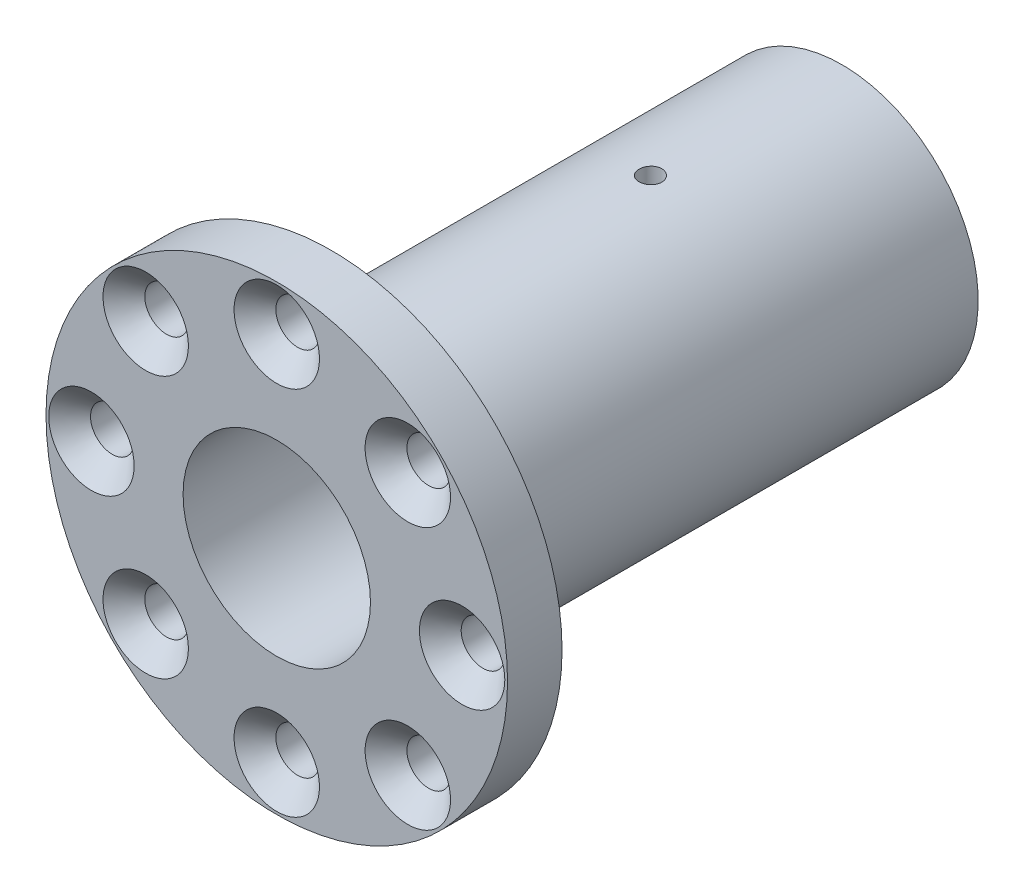
from build123d import *

# Parameters (mm, degrees)
SKETCH1_W                                       = 25.4
SKETCH1_H                                       = 6
SKETCH2_R                                       = 15
BOSS_EXTRUDE1_DEPTH                             = 56.2
CUT_EXTRUDE1_DEPTH                              = 24.1
SKETCH5_W                                       = 1.25
SKETCH5_H                                       = 16.341500105
M3X0_5_TAPPED_HOLE1_D                           = 2.5
M3X0_5_TAPPED_HOLE1_DEPTH                       = 12
M3X0_5_TAPPED_HOLE1_TIP                         = 0.751075774
CSK_FOR_M4_FLAT_HEAD_MACHINE_SCREW1_D           = 4.8
CSK_FOR_M4_FLAT_HEAD_MACHINE_SCREW1_CSINK_D     = 9.4
CSK_FOR_M4_FLAT_HEAD_MACHINE_SCREW1_CSINK_ANGLE = 90


with BuildPart() as part:
    # Sketch1 → Revolve1 (revolve)
    with BuildSketch(Plane.XZ, mode=Mode.PRIVATE) as revolve1_sk:
        with Locations((12.7, 58.54)):
            Rectangle(SKETCH1_W, SKETCH1_H)
    revolve(revolve1_sk.sketch.rotate(Axis((0, 0, 61.54), (0, 0, -1)), 180), axis=Axis((0, 0, 61.54), (0, 0, -1)))

    # Sketch2 → Boss-Extrude1 (add)
    with BuildSketch(Plane(origin=(0, 0, 55.54), x_dir=(-1, 0, 0), z_dir=(0, 0, -1))):
        Circle(SKETCH2_R)
    extrude(amount=BOSS_EXTRUDE1_DEPTH)

    # Sketch3 → Cut-Extrude1 (cut)
    with BuildSketch(Plane(origin=(0, 0, -0.66), x_dir=(-1, 0, 0), z_dir=(0, 0, -1))):
        with BuildLine():
            Line((2.5, 9.058499895), (-2.5, 9.058499895))
            Line((-2.5, 9.058499895), (-2.5, 6.549481518))
            ThreePointArc((-2.5, 6.549481518), (0, 7.0104), (2.5, 6.549481518))
            Line((2.5, 6.549481518), (2.5, 9.058499895))
        make_face()
    extrude(amount=-CUT_EXTRUDE1_DEPTH, mode=Mode.SUBTRACT)

    # Sketch4 → Cut-Revolve1 (revolve, cut)
    with BuildSketch(Plane(origin=(0, 0, 0), x_dir=(1, 0, 0), z_dir=(0, 1, 0))):
        Polygon((7.0104, 0.66), (0, 0.66), (0, -61.54), (10.3124, -61.54), (10.3124, -23.44), (7.0104, -23.44), align=None)
    revolve(axis=Axis((0, 0, -0.66), (0, 0, 1)), mode=Mode.SUBTRACT)

    # Sketch5 → M3x0.5 Tapped Hole2 (revolve, cut)
    with BuildSketch(Plane(origin=(0, 9.058499895, 20.422), x_dir=(0, 0, -1), z_dir=(1, 0, 0))):
        with Locations((0.625, 8.170750053)):
            Rectangle(SKETCH5_W, SKETCH5_H)
    revolve(axis=Axis((0, 2.708499895, 20.422), (0, 1, 0)), mode=Mode.SUBTRACT)

    # M3x0.5 Tapped Hole1
    with Locations(Plane(origin=(0, 0, -0.66), x_dir=(-1, 0, 0), z_dir=(0, 0, -1))):
        with Locations((-11.5, 0), (-5.75, -9.959292144), (5.75, -9.959292144), (11.5, 0), (5.75, 9.959292144), (-5.75, 9.959292144)):
            Hole(M3X0_5_TAPPED_HOLE1_D / 2, depth=M3X0_5_TAPPED_HOLE1_DEPTH)
            with Locations((0, 0, -(M3X0_5_TAPPED_HOLE1_DEPTH + M3X0_5_TAPPED_HOLE1_TIP / 2))):  # 118° drill point
                Cone(0, M3X0_5_TAPPED_HOLE1_D / 2, M3X0_5_TAPPED_HOLE1_TIP, mode=Mode.SUBTRACT)

    # CSK for M4 Flat Head Machine Screw1 (through all)
    with Locations(Plane.XY.offset(61.54)):
        with Locations((0, 20.4), (14.424978336, 14.424978336), (20.4, 0), (14.424978336, -14.424978336), (0, -20.4), (-14.424978336, -14.424978336), (-20.4, 0), (-14.424978336, 14.424978336)):
            CounterSinkHole(CSK_FOR_M4_FLAT_HEAD_MACHINE_SCREW1_D / 2, CSK_FOR_M4_FLAT_HEAD_MACHINE_SCREW1_CSINK_D / 2, counter_sink_angle=CSK_FOR_M4_FLAT_HEAD_MACHINE_SCREW1_CSINK_ANGLE)


solid = part.part
